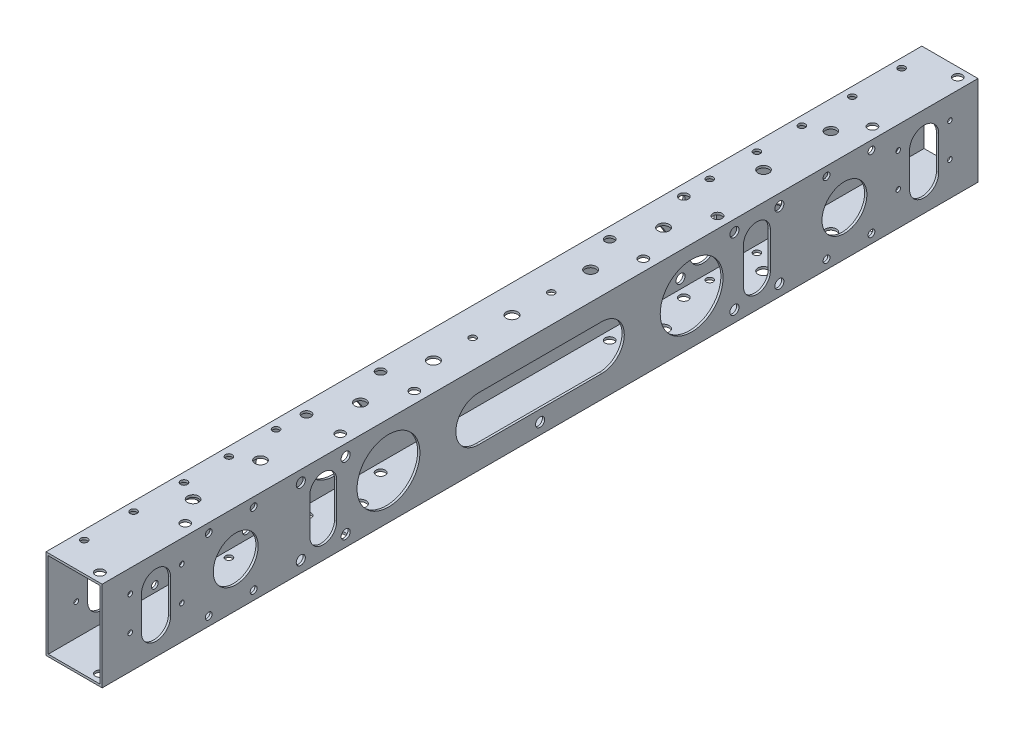
from build123d import *

# Parameters (mm, degrees)
SKETCH_1_W           = 25
SKETCH_1_H           = 40
SKETCH_1_W_2         = 23
SKETCH_1_H_2         = 38
EXTRUDE_1_DEPTH      = 195
SKETCH_3_R           = 14
CUT_EXTRUDE_1_DEPTH  = 40
SKETCH_4_R           = 2.025
CUT_EXTRUDE_2_DEPTH  = 75
SKETCH_5_R           = 2.5
CUT_EXTRUDE_3_DEPTH  = 55
SKETCH_6_R           = 2.025
CUT_EXTRUDE_4_DEPTH  = 90
SKETCH_8_R           = 1.525
CUT_EXTRUDE_6_DEPTH  = 140
CUT_EXTRUDE_7_DEPTH  = 140
SKETCH_11_R          = 1.025
CUT_EXTRUDE_8_DEPTH  = 96
CUT_EXTRUDE_START    = -96
SKETCH_13_R          = 1.025
CUT_EXTRUDE_9_DEPTH  = 96
SKETCH_14_R          = 1.525
CUT_EXTRUDE_10_DEPTH = 33
CUT_EXTRUDE_12_DEPTH = 33
SKETCH_19_R          = 2.025
CUT_EXTRUDE_15_DEPTH = 80
SKETCH_20_R          = 2.475
CUT_EXTRUDE_16_DEPTH = 80
SKETCH_22_R          = 2.525
CUT_EXTRUDE_18_DEPTH = 10
SKETCH_25_R          = 1.525000002
CUT_EXTRUDE_20_DEPTH = 16
CUT_EXTRUDE_21_DEPTH = 86
SKETCH_27_R          = 2.025
CUT_EXTRUDE_22_DEPTH = 10
SKETCH_30_R          = 10
CUT_EXTRUDE_25_DEPTH = 78
SKETCH_33_R          = 1.525
CUT_EXTRUDE_28_DEPTH = 78
SKETCH_34_R          = 1.525
CUT_EXTRUDE_29_DEPTH = 78
SKETCH_35_R          = 2.025
CUT_EXTRUDE_30_DEPTH = 5


with BuildPart() as part:
    # 草图1 → 凸台-拉伸1 (new, symmetric)
    with BuildSketch(Plane.XY):
        Rectangle(SKETCH_1_W, SKETCH_1_H)
        Rectangle(SKETCH_1_W_2, SKETCH_1_H_2, mode=Mode.SUBTRACT)
    extrude(amount=EXTRUDE_1_DEPTH, both=True)

    # 草图3 → 切除-拉伸1 (cut, symmetric)
    with BuildSketch(Plane(origin=(12.5, 0, 0), x_dir=(0, 0, -1), z_dir=(1, 0, 0))):
        with Locations((-67.5, 0)):
            Circle(SKETCH_3_R)
        with Locations((67.5, 0)):
            Circle(SKETCH_3_R)
    extrude(amount=CUT_EXTRUDE_1_DEPTH, both=True, mode=Mode.SUBTRACT)

    # 草图4 → 切除-拉伸2 (cut, symmetric)
    with BuildSketch(Plane(origin=(0, 20, 0), x_dir=(1, 0, 0), z_dir=(0, 1, 0))):
        with Locations(Location((-7.5, -51, 0), (0, 0, 90))):
            Circle(SKETCH_4_R)
        with Locations(Location((-7.5, -84, 0), (0, 0, 90))):
            Circle(SKETCH_4_R)
        with Locations(Location((-7.5, 84, 0), (0, 0, 90))):
            Circle(SKETCH_4_R)
        with Locations(Location((-7.5, 51, 0), (0, 0, 90))):
            Circle(SKETCH_4_R)
    cut_extrude_2 = extrude(amount=CUT_EXTRUDE_2_DEPTH, both=True, mode=Mode.SUBTRACT)

    # 镜向1: 切除-拉伸2 across plane
    add(cut_extrude_2.mirror(Plane(origin=(0, 0, 0), x_dir=(0, 0, 1), z_dir=(1, 0, 0))), mode=Mode.SUBTRACT)

    # 草图5 → 切除-拉伸3 (cut, symmetric)
    with BuildSketch(Plane(origin=(0, 20, 0), x_dir=(1, 0, 0), z_dir=(0, 1, 0))):
        with Locations(Location((0, 67.5, 0), (0, 0, 90))):
            Circle(SKETCH_5_R)
        with Locations(Location((0, -67.5, 0), (0, 0, 90))):
            Circle(SKETCH_5_R)
    extrude(amount=CUT_EXTRUDE_3_DEPTH, both=True, mode=Mode.SUBTRACT)

    # 草图6 → 切除-拉伸4 (cut)
    with BuildSketch(Plane(origin=(12.5, 0, 0), x_dir=(0, 0, -1), z_dir=(1, 0, 0))):
        with Locations((86.55, -14.95)):
            Circle(SKETCH_6_R)
        with Locations((86.55, 14.95)):
            Circle(SKETCH_6_R)
        with Locations((106.55, 14.95)):
            Circle(SKETCH_6_R)
        with Locations((106.55, -14.95)):
            Circle(SKETCH_6_R)
        with Locations((-106.55, -14.95)):
            Circle(SKETCH_6_R)
        with Locations((-106.55, 14.95)):
            Circle(SKETCH_6_R)
        with Locations((-86.55, 14.95)):
            Circle(SKETCH_6_R)
        with Locations((-86.55, -14.95)):
            Circle(SKETCH_6_R)
    extrude(amount=-CUT_EXTRUDE_4_DEPTH, mode=Mode.SUBTRACT)

    # 草图8 → 切除-拉伸6 (cut)
    with BuildSketch(Plane(origin=(0, 20, 0), x_dir=(1, 0, 0), z_dir=(0, 1, 0))):
        with Locations(Location((-8.5, 96.55, 0), (0, 0, 270))):
            Circle(SKETCH_8_R)
        with Locations(Location((-8.5, -96.55, 0), (0, 0, 90))):
            Circle(SKETCH_8_R)
    extrude(amount=-CUT_EXTRUDE_6_DEPTH, mode=Mode.SUBTRACT)

    # 草图9 → 切除-拉伸7 (cut)
    with BuildSketch(Plane(origin=(12.5, 0, 0), x_dir=(0, 0, -1), z_dir=(1, 0, 0))):
        with BuildLine():
            Line((90.55, -8), (90.55, 8))
            ThreePointArc((90.55, 8), (96.55, 14), (102.55, 8))
            Line((102.55, 8), (102.55, -8))
            ThreePointArc((102.55, -8), (96.55, -14), (90.55, -8))
        make_face()
    cut_extrude_7 = extrude(amount=-CUT_EXTRUDE_7_DEPTH, mode=Mode.SUBTRACT)

    # 镜向2: 切除-拉伸7 across plane
    add(cut_extrude_7.mirror(Plane.XY), mode=Mode.SUBTRACT)

    # 草图11 → 切除-拉伸8 (cut)
    with BuildSketch(Plane.ZY.offset(-11.5)):
        with Locations((159.5, -5)):
            Circle(SKETCH_11_R)
        with Locations((159.5, 10)):
            Circle(SKETCH_11_R)
        with Locations((182.5, -5)):
            Circle(SKETCH_11_R)
        with Locations((182.5, 10)):
            Circle(SKETCH_11_R)
        with Locations((-182.5, 10)):
            Circle(SKETCH_11_R)
        with Locations((-182.5, -5)):
            Circle(SKETCH_11_R)
        with Locations((-159.5, 10)):
            Circle(SKETCH_11_R)
        with Locations((-159.5, -5)):
            Circle(SKETCH_11_R)
    extrude(amount=-CUT_EXTRUDE_8_DEPTH, mode=Mode.SUBTRACT)

    # 草图13 → 切除-拉伸9 (cut)
    with BuildSketch(Plane(origin=(-11.5, 0, 0), x_dir=(0, 0, -1), z_dir=(1, 0, 0)).offset(CUT_EXTRUDE_START)):
        with Locations(Location((-182.5, 10, 0), (0, 0, 180))):
            Circle(SKETCH_13_R)
        with Locations(Location((-182.5, -5, 0), (0, 0, 180))):
            Circle(SKETCH_13_R)
        with Locations(Location((-159.5, 10, 0), (0, 0, 180))):
            Circle(SKETCH_13_R)
        with Locations(Location((-159.5, -5, 0), (0, 0, 180))):
            Circle(SKETCH_13_R)
        with Locations(Location((159.5, -5, 0), (0, 0, 180))):
            Circle(SKETCH_13_R)
        with Locations(Location((159.5, 10, 0), (0, 0, 180))):
            Circle(SKETCH_13_R)
        with Locations(Location((182.5, -5, 0), (0, 0, 180))):
            Circle(SKETCH_13_R)
        with Locations(Location((182.5, 10, 0), (0, 0, 180))):
            Circle(SKETCH_13_R)
    extrude(amount=CUT_EXTRUDE_9_DEPTH, mode=Mode.SUBTRACT)

    # 草图14 → 切除-拉伸10 (cut, symmetric)
    with BuildSketch(Plane(origin=(0, 20, 0), x_dir=(1, 0, 0), z_dir=(0, 1, 0))):
        with Locations(Location((-8.5, -160, 0), (0, 0, 90))):
            Circle(SKETCH_14_R)
        with Locations(Location((-8.5, -182, 0), (0, 0, 90))):
            Circle(SKETCH_14_R)
        with Locations(Location((-8.5, 182, 0), (0, 0, 90))):
            Circle(SKETCH_14_R)
        with Locations(Location((-8.5, 160, 0), (0, 0, 90))):
            Circle(SKETCH_14_R)
    extrude(amount=CUT_EXTRUDE_10_DEPTH, both=True, mode=Mode.SUBTRACT)

    # 草图16 → 切除-拉伸12 (cut, symmetric)
    with BuildSketch(Plane.ZY.offset(12.5)):
        with BuildLine():
            Line((164.5, -7.5), (164.5, 7.5))
            ThreePointArc((164.5, 7.5), (171, 14), (177.5, 7.5))
            Line((177.5, 7.5), (177.5, -7.5))
            ThreePointArc((177.5, -7.5), (171, -14), (164.5, -7.5))
        make_face()
    cut_extrude_12 = extrude(amount=CUT_EXTRUDE_12_DEPTH, both=True, mode=Mode.SUBTRACT)

    # 镜向3: 切除-拉伸12 across plane
    add(cut_extrude_12.mirror(Plane.XY), mode=Mode.SUBTRACT)

    # 草图19 → 切除-拉伸15 (cut, symmetric)
    with BuildSketch(Plane(origin=(0, 20, 0), x_dir=(1, 0, 0), z_dir=(0, 1, 0))):
        with Locations(Location((7.5, -153, 0), (0, 0, 90))):
            Circle(SKETCH_19_R)
        with Locations(Location((7.5, -191, 0), (0, 0, 90))):
            Circle(SKETCH_19_R)
        with Locations(Location((7.5, 191, 0), (0, 0, 90))):
            Circle(SKETCH_19_R)
        with Locations(Location((7.5, 153, 0), (0, 0, 90))):
            Circle(SKETCH_19_R)
    extrude(amount=CUT_EXTRUDE_15_DEPTH, both=True, mode=Mode.SUBTRACT)

    # 草图20 → 切除-拉伸16 (cut)
    with BuildSketch(Plane.XZ.offset(20)):
        with Locations(Location((0, 142, 0), (0, 0, 270))):
            Circle(SKETCH_20_R)
        with Locations(Location((0, 112, 0), (0, 0, 270))):
            Circle(SKETCH_20_R)
        with Locations(Location((0, -112, 0), (0, 0, 270))):
            Circle(SKETCH_20_R)
        with Locations(Location((0, -142, 0), (0, 0, 270))):
            Circle(SKETCH_20_R)
    extrude(amount=-CUT_EXTRUDE_16_DEPTH, mode=Mode.SUBTRACT)

    # 草图22 → 切除-拉伸18 (cut)
    with BuildSketch(Plane(origin=(0, 20, 0), x_dir=(1, 0, 0), z_dir=(0, 1, 0))):
        with Locations(Location((-1e-09, 35.000000001, 0), (0, 0, 270))):
            Circle(SKETCH_22_R)
        with Locations(Location((-1e-09, 1e-09, 0), (0, 0, 270))):
            Circle(SKETCH_22_R)
        with Locations(Location((-1e-09, -34.999999999, 0), (0, 0, 270))):
            Circle(SKETCH_22_R)
    extrude(amount=-CUT_EXTRUDE_18_DEPTH, mode=Mode.SUBTRACT)

    # 草图25 → 切除-拉伸20 (cut)
    with BuildSketch(Plane(origin=(0, 20, 0), x_dir=(1, 0, 0), z_dir=(0, 1, 0))):
        with Locations(Location((0, 17.500000001, 0), (0, 0, 270))):
            Circle(SKETCH_25_R)
        with Locations(Location((0, -17.499999999, 0), (0, 0, 270))):
            Circle(SKETCH_25_R)
    extrude(amount=-CUT_EXTRUDE_20_DEPTH, mode=Mode.SUBTRACT)

    # 草图26 → 切除-拉伸21 (cut)
    with BuildSketch(Plane(origin=(12.5, 0, 0), x_dir=(0, 0, -1), z_dir=(1, 0, 0))):
        with BuildLine():
            Line((-27.5, 10), (27.5, 10))
            ThreePointArc((27.5, 10), (37.5, 0), (27.5, -10))
            Line((27.5, -10), (-27.5, -10))
            ThreePointArc((-27.5, -10), (-37.5, 0), (-27.5, 10))
        make_face()
    extrude(amount=-CUT_EXTRUDE_21_DEPTH, mode=Mode.SUBTRACT)

    # 草图27 → 切除-拉伸22 (cut)
    with BuildSketch(Plane.XZ.offset(20)):
        with Locations(Location((7.5, 15, 0), (0, 0, 270))):
            Circle(SKETCH_27_R)
        with Locations(Location((7.5, -15, 0), (0, 0, 270))):
            Circle(SKETCH_27_R)
    extrude(amount=-CUT_EXTRUDE_22_DEPTH, mode=Mode.SUBTRACT)

    # 草图30 → 切除-拉伸25 (cut)
    with BuildSketch(Plane(origin=(12.5, 0, 0), x_dir=(0, 0, -1), z_dir=(1, 0, 0))):
        with Locations((135.525, 0)):
            Circle(SKETCH_30_R)
    cut_extrude_25 = extrude(amount=-CUT_EXTRUDE_25_DEPTH, mode=Mode.SUBTRACT)

    # 镜向6: 切除-拉伸25 across plane
    add(cut_extrude_25.mirror(Plane.XY), mode=Mode.SUBTRACT)

    # 草图33 → 切除-拉伸28 (cut)
    with BuildSketch(Plane(origin=(0, 20, 0), x_dir=(1, 0, 0), z_dir=(0, 1, 0))):
        with Locations(Location((-8.5, -117.55, 0), (0, 0, 270))):
            Circle(SKETCH_33_R)
        with Locations(Location((-8.5, -137.55, 0), (0, 0, 270))):
            Circle(SKETCH_33_R)
        with Locations(Location((-8.5, 137.55, 0), (0, 0, 90))):
            Circle(SKETCH_33_R)
        with Locations(Location((-8.5, 117.55, 0), (0, 0, 90))):
            Circle(SKETCH_33_R)
    extrude(amount=-CUT_EXTRUDE_28_DEPTH, mode=Mode.SUBTRACT)

    # 草图34 → 切除-拉伸29 (cut)
    with BuildSketch(Plane.ZY.offset(12.5)):
        with Locations((127.55, 16)):
            Circle(SKETCH_34_R)
        with Locations((147.55, 16)):
            Circle(SKETCH_34_R)
        with Locations(Location((147.55, -16, 0), (0, 0, 180))):
            Circle(SKETCH_34_R)
        with Locations(Location((127.55, -16, 0), (0, 0, 180))):
            Circle(SKETCH_34_R)
    cut_extrude_29 = extrude(amount=-CUT_EXTRUDE_29_DEPTH, mode=Mode.SUBTRACT)

    # 镜向8: 切除-拉伸29 across plane
    add(cut_extrude_29.mirror(Plane.XY), mode=Mode.SUBTRACT)

    # 草图35 → 切除-拉伸30 (cut, symmetric)
    with BuildSketch(Plane(origin=(12.5, 0, 0), x_dir=(0, 0, -1), z_dir=(1, 0, 0))):
        with Locations(Location((0, -15, 0), (0, 0, 180))):
            Circle(SKETCH_35_R)
    extrude(amount=CUT_EXTRUDE_30_DEPTH, both=True, mode=Mode.SUBTRACT)


solid = part.part
